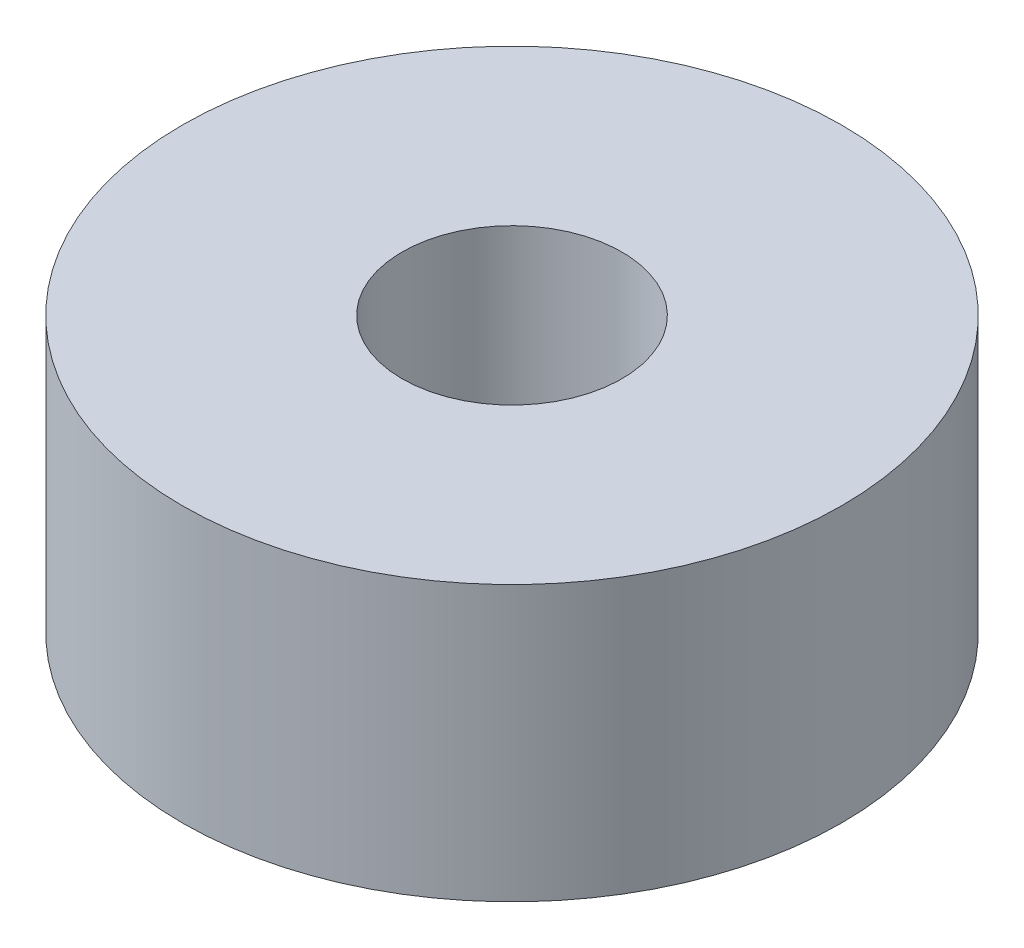
from build123d import *

# Parameters (mm, degrees)
SKETCH_1_R      = 3
SKETCH_1_R_2    = 1
EXTRUDE_1_DEPTH = 2.5


with BuildPart() as part:
    # 草图1 → 凸台-拉伸1 (new body)
    with BuildSketch(Plane(origin=(0, 0, 0), x_dir=(1, 0, 0), z_dir=(0, 1, 0))):
        with Locations(Location((0, 0, 0), (0, 0, 270))):
            Circle(SKETCH_1_R)
        with Locations(Location((0, 0, 0), (0, 0, 270))):
            Circle(SKETCH_1_R_2, mode=Mode.SUBTRACT)
    extrude(amount=EXTRUDE_1_DEPTH)


solid = part.part
